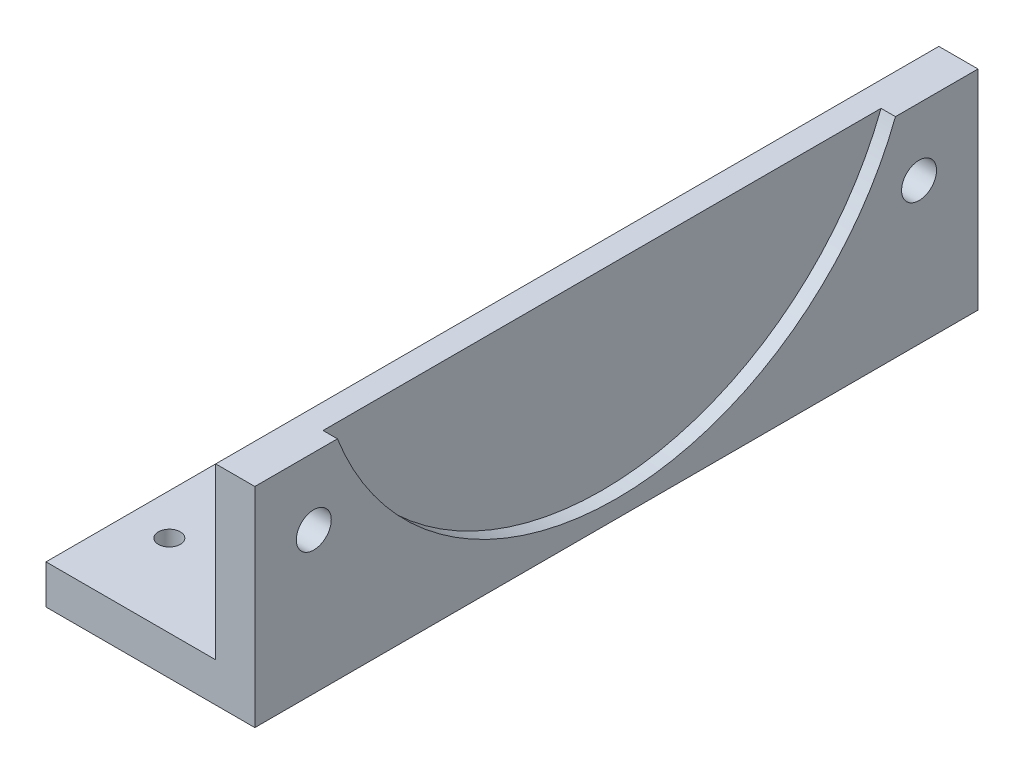
from build123d import *

# Parameters (mm, degrees)
BOSS_EXTRUDE1_DEPTH          = 190
SKETCH3_R                    = 72.75
CUT_EXTRUDE3_DEPTH           = 3.5
CUT_EXTRUDE4_DEPTH           = 7.05
CUT_EXTRUDE5_DEPTH           = 7.05
TAP_DRILL_FOR_M10X1_5_TAP1_D = 8.5
CUT_EXTRUDE6_REACH           = 191.26
SKETCH8_R                    = 2.665


with BuildPart() as part:
    # Sketch1 → Boss-Extrude1 (new body)
    with BuildSketch(Plane.XY):
        Polygon((-25.4, -25.4), (25.4, -25.4), (25.4, 25.4), (15.875, 25.4), (15.875, -15.875), (-25.4, -15.875), align=None)
    extrude(amount=BOSS_EXTRUDE1_DEPTH)

    # Sketch3 → Cut-Extrude3 (cut)
    with BuildSketch(Plane(origin=(25.4, 0, 0), x_dir=(0, 0, -1), z_dir=(1, 0, 0))):
        with Locations((-95, 51.6)):
            Circle(SKETCH3_R)
    extrude(amount=-CUT_EXTRUDE3_DEPTH, mode=Mode.SUBTRACT)

    # Sketch4 → Cut-Extrude4 (cut)
    with BuildSketch(Plane.XY.offset(190)):
        Polygon((25.4, -25.4), (25.4, 25.4), (15.875, 25.4), (15.875, -15.875), (-25.4, -15.875), (-25.4, -25.4), align=None)
    extrude(amount=-CUT_EXTRUDE4_DEPTH, mode=Mode.SUBTRACT)

    # Sketch5 → Cut-Extrude5 (cut)
    with BuildSketch(Plane(origin=(0, 0, 0), x_dir=(-1, 0, 0), z_dir=(0, 0, -1))):
        Polygon((-25.4, 25.4), (-25.4, -25.4), (25.4, -25.4), (25.4, -15.875), (-15.875, -15.875), (-15.875, 25.4), align=None)
    extrude(amount=-CUT_EXTRUDE5_DEPTH, mode=Mode.SUBTRACT)

    # Tap Drill for M10x1.5 Tap1 (through all)
    with Locations(Plane(origin=(25.4, 9.1, 168.612159322), x_dir=(0, 0, 1), z_dir=(1, 0, 0))):
        with Locations((0, 0), (-147.224318644, 0)):
            Hole(TAP_DRILL_FOR_M10X1_5_TAP1_D / 2)

    # Sketch8 → Cut-Extrude6 (cut, up to next)
    with BuildSketch(Plane(origin=(0, -15.875, 0), x_dir=(1, 0, 0), z_dir=(0, 1, 0)), mode=Mode.PRIVATE) as cut_extrude6_sk1:
        with Locations(Location((-15.4, -27.05, 0), (0, 0, 270))):
            Circle(SKETCH8_R)
    cut_extrude6_tool1 = extrude(cut_extrude6_sk1.sketch, amount=-CUT_EXTRUDE6_REACH, mode=Mode.PRIVATE) & part.part
    # Sketch8 → Cut-Extrude6 (cut, up to next)
    with BuildSketch(Plane(origin=(0, -15.875, 0), x_dir=(1, 0, 0), z_dir=(0, 1, 0)), mode=Mode.PRIVATE) as cut_extrude6_sk2:
        with Locations(Location((4.6, -95, 0), (0, 0, 270))):
            Circle(SKETCH8_R)
    cut_extrude6_tool2 = extrude(cut_extrude6_sk2.sketch, amount=-CUT_EXTRUDE6_REACH, mode=Mode.PRIVATE) & part.part
    # Sketch8 → Cut-Extrude6 (cut, up to next)
    with BuildSketch(Plane(origin=(0, -15.875, 0), x_dir=(1, 0, 0), z_dir=(0, 1, 0)), mode=Mode.PRIVATE) as cut_extrude6_sk3:
        with Locations(Location((-15.4, -162.95, 0), (0, 0, 270))):
            Circle(SKETCH8_R)
    cut_extrude6_tool3 = extrude(cut_extrude6_sk3.sketch, amount=-CUT_EXTRUDE6_REACH, mode=Mode.PRIVATE) & part.part
    add(cut_extrude6_tool1.solids().sort_by_distance((-15.4, -15.875, 27.05))[0], mode=Mode.SUBTRACT)
    add(cut_extrude6_tool2.solids().sort_by_distance((4.6, -15.875, 95))[0], mode=Mode.SUBTRACT)
    add(cut_extrude6_tool3.solids().sort_by_distance((-15.4, -15.875, 162.95))[0], mode=Mode.SUBTRACT)


solid = part.part
